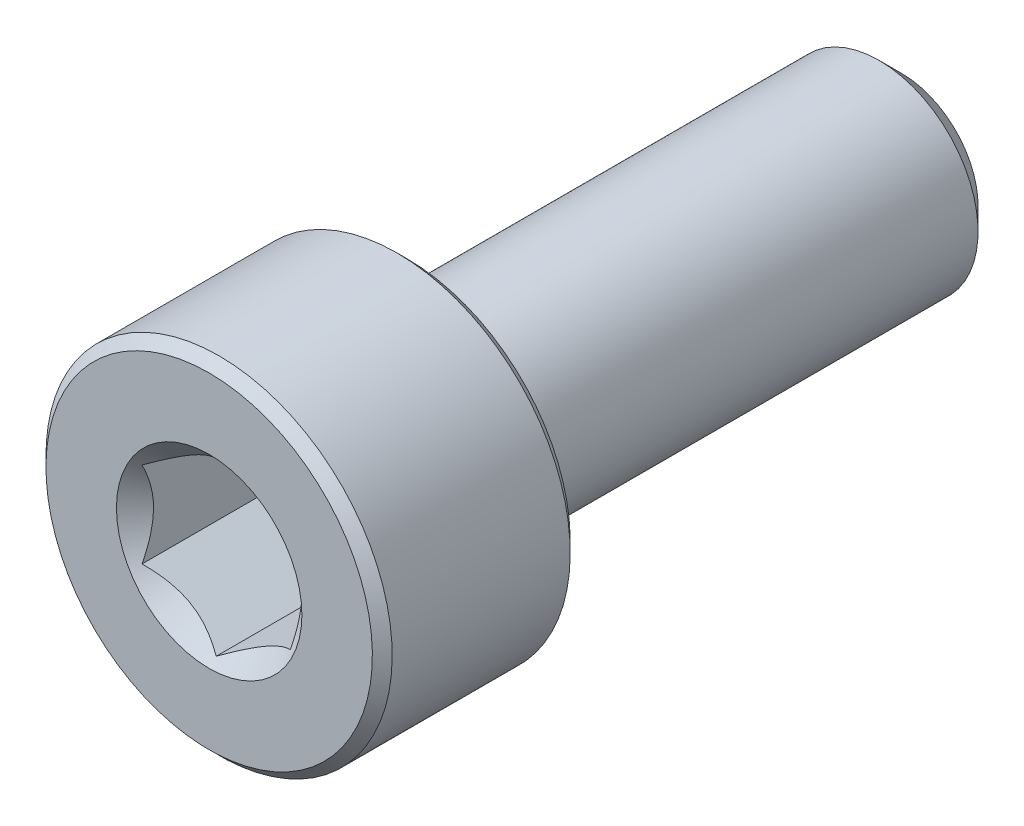
from build123d import *

# Parameters (mm, degrees)
CUT_EXTRUDE1_DEPTH = 3


with BuildPart() as part:
    # Sketch2 → Revolve1 (revolve)
    with BuildSketch(Plane(origin=(0, 0, 0), x_dir=(0, 0, -1), z_dir=(1, 0, 0))):
        with BuildLine():
            Line((-7, 0), (-7, 3.3))
            Line((-7, 3.3), (-6.8, 3.5))
            Line((-6.8, 3.5), (-3.2, 3.5))
            Line((-3.2, 3.5), (-3, 3.3))
            Line((-3, 3.3), (-3, 2.2))
            ThreePointArc((-3, 2.2), (-2.941421356, 2.058578644), (-2.8, 2))
            Line((-2.8, 2), (6.545336663, 2))
            Line((6.545336663, 2), (7, 1.545336663))
            Line((7, 1.545336663), (7, 0))
            Line((7, 0), (-7, 0))
        make_face()
    revolve(axis=Axis((0, 0, -7), (0, 0, 1)))

    # Sketch3 → Cut-Extrude1 (cut)
    with BuildSketch(Plane.XY.offset(7)):
        Polygon((1.5, -0.866025404), (1.5, 0.866025404), (0, 1.732050808), (-1.5, 0.866025404), (-1.5, -0.866025404), (0, -1.732050808), align=None)
    extrude(amount=-CUT_EXTRUDE1_DEPTH, mode=Mode.SUBTRACT)

    # Cut-Extrude2 cone 1 section (through the dimple's axis) → Cut-Extrude2 (revolve, cut)
    with BuildSketch(Plane(origin=(0, 0, 7), x_dir=(0, -1, 0), z_dir=(1, 0, 0))):
        Polygon((0, 0), (1.875, 0), (0, 1.875), align=None)
    revolve(axis=Axis((0, 0, 7), (0, 0, -1)), mode=Mode.SUBTRACT)


solid = part.part
